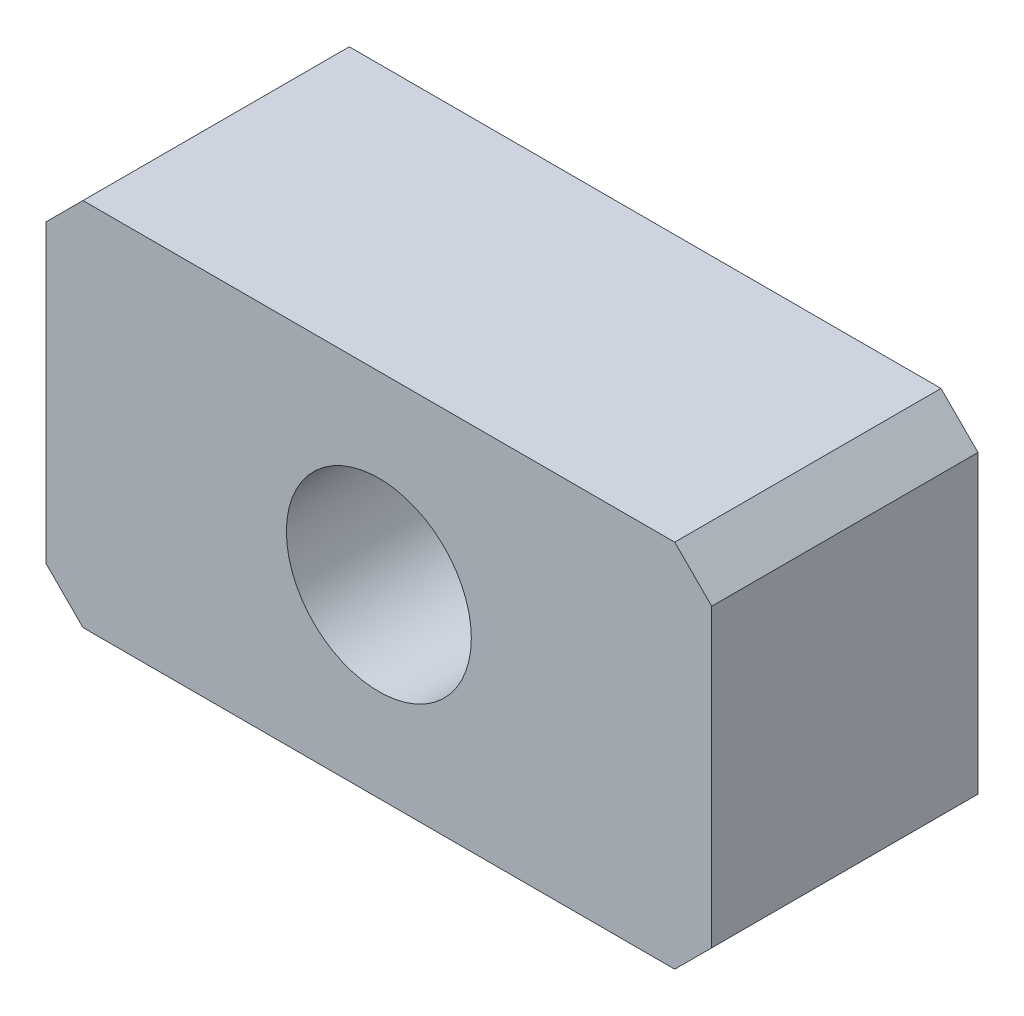
from build123d import *

# Parameters (mm, degrees)
BOSS_EXTRUDE1_DEPTH = 7.2
SKETCH2_R           = 2.5
CUT_EXTRUDE1_DEPTH  = 10


with BuildPart() as part:
    # Sketch1 → Boss-Extrude1 (new body)
    with BuildSketch(Plane.XY):
        Polygon((8, 5), (-8, 5), (-9, 4), (-9, -4), (-8, -5), (8, -5), (9, -4), (9, 4), align=None)
    extrude(amount=BOSS_EXTRUDE1_DEPTH)

    # Sketch2 → Cut-Extrude1 (cut)
    with BuildSketch(Plane.XY.offset(7.2)):
        Circle(SKETCH2_R)
    extrude(amount=-CUT_EXTRUDE1_DEPTH, mode=Mode.SUBTRACT)


solid = part.part
